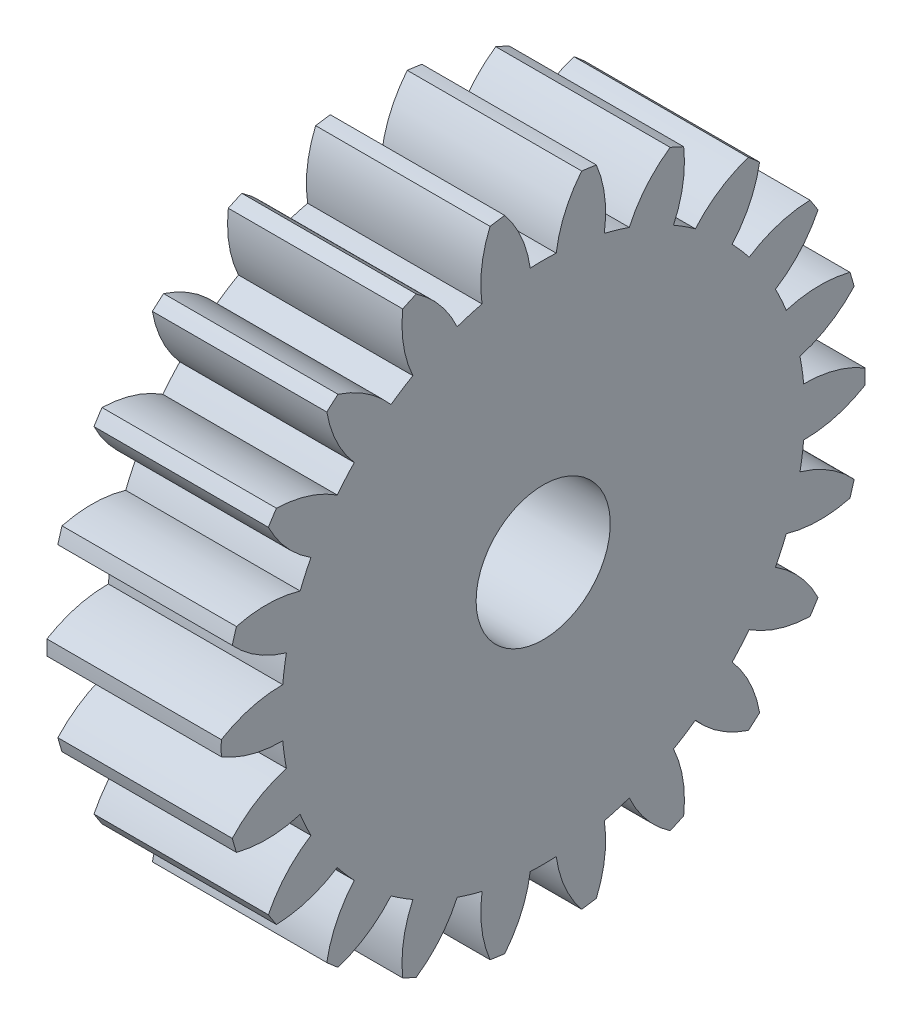
from build123d import *

# Parameters (mm, degrees)
BASPROSKE_W      = 13
BASPROSKE_H      = 24
TOOTHCUT_DEPTH   = 37.345563691
TEETHCUTS_COUNT  = 22
TEETHCUTS_ANGLE  = 343.636363636
HUBNEAONESKE_R   = 6
HUBNEARONE_DEPTH = 4.0000508
BORSKE_R         = 5
BORE_DEPTH       = 17.0000508
SCALE1_SCALE     = 0.317565217


with BuildPart() as part:
    # BasProSke → Base-Revolve (revolve)
    with BuildSketch(Plane(origin=(0, 0, 0), x_dir=(1, 0, 0), z_dir=(0, 1, 0)), mode=Mode.PRIVATE) as base_revolve_sk:
        with Locations((6.5, 12)):
            Rectangle(BASPROSKE_W, BASPROSKE_H)
    revolve(base_revolve_sk.sketch.rotate(Axis((-10, 0, 0), (1, 0, 0)), 180), axis=Axis((-10, 0, 0), (1, 0, 0)))

    # TooCutSke → ToothCut (cut, through all)
    with BuildSketch(Plane(origin=(0, 0, 0), x_dir=(0, 0, -1), z_dir=(1, 0, 0))):
        with BuildLine():
            ThreePointArc((0.968170358, 19.474949221), (0, 19.499), (-0.968170358, 19.474949221))
            ThreePointArc((-0.968170358, 19.474949221), (-1.624144469, 21.795843598), (-2.885568663, 23.851485041))
            ThreePointArc((-2.885568663, 23.851485041), (0, 24.0254), (2.885568663, 23.851485041))
            ThreePointArc((2.885568663, 23.851485041), (1.624144469, 21.795843598), (0.968170358, 19.474949221))
        make_face()
    toothcut = extrude(amount=TOOTHCUT_DEPTH, mode=Mode.SUBTRACT)

    # TeethCuts: ToothCut ×22 about axis
    teethcuts_axis = Axis((-10, 0, 0), (1, 0, 0))
    for i in range(1, TEETHCUTS_COUNT):
        add(toothcut.rotate(teethcuts_axis, i * TEETHCUTS_ANGLE / (TEETHCUTS_COUNT - 1)), mode=Mode.SUBTRACT)

    # HubNeaOneSke → HubNearOne (add)
    with BuildSketch(Plane.ZY):
        with Locations(Location((0, 0, 0), (0, 0, 180))):
            Circle(HUBNEAONESKE_R)
    extrude(amount=HUBNEARONE_DEPTH)

    # BorSke → Bore (cut, symmetric)
    with BuildSketch(Plane(origin=(0, 0, 0), x_dir=(0, 0, -1), z_dir=(1, 0, 0))):
        with Locations(Location((0, 0, 0), (0, 0, 180))):
            Circle(BORSKE_R)
    extrude(amount=BORE_DEPTH, both=True, mode=Mode.SUBTRACT)


with BuildPart() as part_1:
    # Scale1: scaled about (6.435728892, 0, 0)
    add(part.part.scale(SCALE1_SCALE).moved(Location((4.39196525, 0, 0))))


solid = part_1.part
